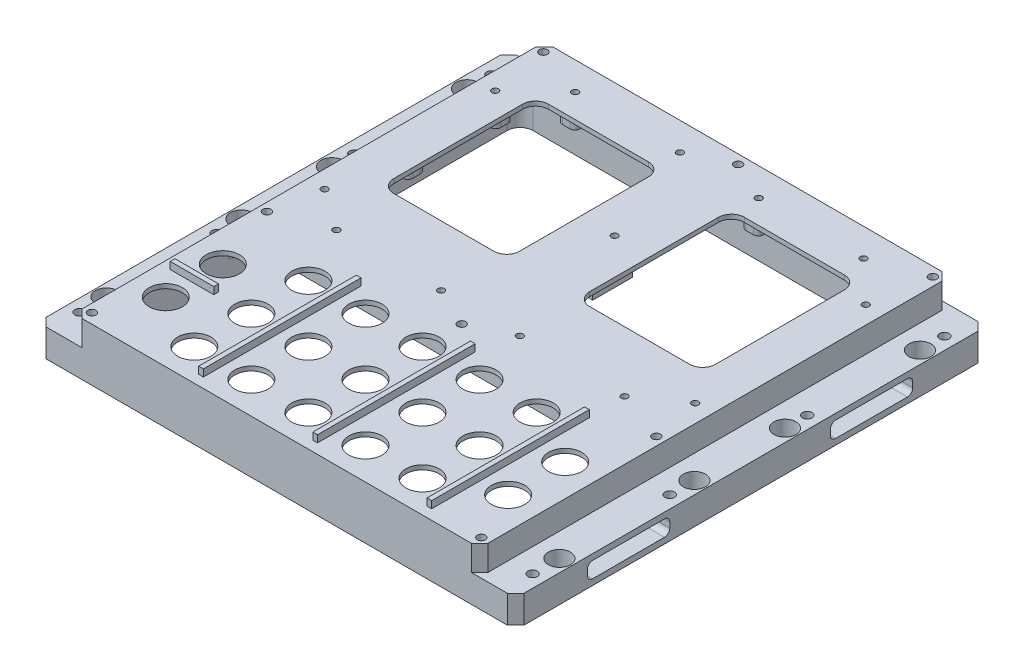
from build123d import *

# Parameters (mm, degrees)
BOSS_EXTRUDE1_DEPTH      = 22.8727
SKETCH3_W                = 15.5448
SKETCH3_H                = 10.922
CUT_EXTRUDE1_DEPTH       = 291.505693275
CHAMFER1_SIZE            = 3.556
SKETCH4_R                = 7.18185
CUT_EXTRUDE2_DEPTH       = 291.505693275
SKETCH5_W                = 18.796
SKETCH5_H                = 2.032
SKETCH5_W_2              = 2.032
SKETCH5_H_2              = 68.072
BOSS_EXTRUDE2_DEPTH      = 3.048
CUT_EXTRUDE3_DEPTH       = 7.874
FILLET1_R                = 2.286
CUT_EXTRUDE4_DEPTH       = 12.7
CUT_EXTRUDE5_DEPTH       = 20.9677
HOLE1_D                  = 4.0894
HOLE1_DEPTH              = 11.9507
HOLE1_CBORE_D            = 9.525
HOLE1_CBORE_DEPTH        = 9.652
HOLE1_TIP                = 1.228579708
HOLE2_D                  = 4.0894
HOLE3_D                  = 3.5052
HOLE3_DEPTH              = 7.62
SKETCH19_W               = 7.62
SKETCH19_H               = 17.272
SKETCH19_H_2             = 7.62
CUT_EXTRUDE6_DEPTH       = 20.9677
BOSS_EXTRUDE3_DEPTH      = 10.668
BOSS_EXTRUDE3_DEPTH_BACK = 2.54
SKETCH20_W               = 170.7896
SKETCH20_H               = 2.54
CUT_EXTRUDE7_DEPTH       = 11.938
BOSS_EXTRUDE4_START      = 4.572
SKETCH22_W               = 7.62
SKETCH22_H               = 17.272
SKETCH22_H_2             = 7.62
BOSS_EXTRUDE4_DEPTH      = 4.572
HOLE4_D                  = 2.8448
HOLE4_DEPTH              = 2.54


with BuildPart() as part:
    # Sketch1 → Boss-Extrude1 (new body)
    with BuildSketch(Plane(origin=(0, 0, 0), x_dir=(1, 0, 0), z_dir=(0, 1, 0))):
        Polygon((0, 199.644), (3.556, 203.2), (202.7936, 203.2), (206.3496, 199.644), (206.3496, 3.556), (202.7936, 0), (3.556, 0), (0, 3.556), align=None)
    extrude(amount=BOSS_EXTRUDE1_DEPTH)

    # Sketch3 → Cut-Extrude1 (cut, through all)
    with BuildSketch(Plane(origin=(0, 0, -203.2), x_dir=(-1, 0, 0), z_dir=(0, 0, -1))):
        with Locations((-198.5772, 17.4117)):
            Rectangle(SKETCH3_W, SKETCH3_H)
        with Locations((-7.7724, 17.4117)):
            Rectangle(SKETCH3_W, SKETCH3_H)
    extrude(amount=-CUT_EXTRUDE1_DEPTH, mode=Mode.SUBTRACT)

    # Chamfer1
    chamfer1_edges = [part.edges().sort_by_distance(p)[0] for p in [
        (190.8048, 17.4117, -203.2),
        (190.8048, 17.4117, 0),
        (15.5448, 17.4117, -203.2),
        (15.5448, 17.4117, 0),
    ]]
    chamfer(chamfer1_edges, length=CHAMFER1_SIZE)

    # Sketch4 → Cut-Extrude2 (cut, through all)
    with BuildSketch(Plane(origin=(0, 22.8727, 0), x_dir=(1, 0, 0), z_dir=(0, 1, 0))):
        with BuildLine():
            ThreePointArc((82.8548, 180.848), (86.806112693, 179.211312693), (88.4428, 175.26))
            Line((88.4428, 175.26), (88.4428, 119.634))
            ThreePointArc((88.4428, 119.634), (86.806112693, 115.682687307), (82.8548, 114.046))
            Line((82.8548, 114.046), (39.6748, 114.046))
            ThreePointArc((39.6748, 114.046), (35.723487307, 115.682687307), (34.0868, 119.634))
            Line((34.0868, 119.634), (34.0868, 175.26))
            ThreePointArc((34.0868, 175.26), (35.723487307, 179.211312693), (39.6748, 180.848))
            Line((39.6748, 180.848), (82.8548, 180.848))
        make_face()
        with BuildLine():
            Line((118.6688, 175.26), (118.6688, 119.634))
            ThreePointArc((118.6688, 119.634), (120.305487307, 115.682687307), (124.2568, 114.046))
            Line((124.2568, 114.046), (167.4368, 114.046))
            ThreePointArc((167.4368, 114.046), (171.388112693, 115.682687307), (173.0248, 119.634))
            Line((173.0248, 119.634), (173.0248, 175.26))
            ThreePointArc((173.0248, 175.26), (171.388112693, 179.211312693), (167.4368, 180.848))
            Line((167.4368, 180.848), (124.2568, 180.848))
            ThreePointArc((124.2568, 180.848), (120.305487307, 179.211312693), (118.6688, 175.26))
        make_face()
        with Locations(Location((127.7874, 62.992, 0), (0, 0, 270))):
            Circle(SKETCH4_R)
        with Locations(Location((103.1494, 62.992, 0), (0, 0, 270))):
            Circle(SKETCH4_R)
        with Locations(Location((53.8734, 38.354, 0), (0, 0, 270))):
            Circle(SKETCH4_R)
        with Locations(Location((53.8734, 13.716, 0), (0, 0, 270))):
            Circle(SKETCH4_R)
        with Locations(Location((78.5114, 62.992, 0), (0, 0, 270))):
            Circle(SKETCH4_R)
        with Locations(Location((53.8734, 62.992, 0), (0, 0, 270))):
            Circle(SKETCH4_R)
        with Locations(Location((29.2354, 50.673, 0), (0, 0, 270))):
            Circle(SKETCH4_R)
        with Locations(Location((29.2354, 26.035, 0), (0, 0, 270))):
            Circle(SKETCH4_R)
        with Locations(Location((78.5114, 38.354, 0), (0, 0, 270))):
            Circle(SKETCH4_R)
        with Locations(Location((103.1494, 38.354, 0), (0, 0, 270))):
            Circle(SKETCH4_R)
        with Locations(Location((127.7874, 38.354, 0), (0, 0, 270))):
            Circle(SKETCH4_R)
        with Locations(Location((152.4254, 62.992, 0), (0, 0, 270))):
            Circle(SKETCH4_R)
        with Locations(Location((177.0634, 50.673, 0), (0, 0, 270))):
            Circle(SKETCH4_R)
        with Locations(Location((177.0634, 26.035, 0), (0, 0, 270))):
            Circle(SKETCH4_R)
        with Locations(Location((152.4254, 38.354, 0), (0, 0, 270))):
            Circle(SKETCH4_R)
        with Locations(Location((152.4254, 13.716, 0), (0, 0, 270))):
            Circle(SKETCH4_R)
        with Locations(Location((127.7874, 13.716, 0), (0, 0, 270))):
            Circle(SKETCH4_R)
        with Locations(Location((103.1494, 13.716, 0), (0, 0, 270))):
            Circle(SKETCH4_R)
        with Locations(Location((78.5114, 13.716, 0), (0, 0, 270))):
            Circle(SKETCH4_R)
    extrude(amount=-CUT_EXTRUDE2_DEPTH, mode=Mode.SUBTRACT)

    # Sketch5 → Boss-Extrude2 (add)
    with BuildSketch(Plane(origin=(0, 22.8727, 0), x_dir=(1, 0, 0), z_dir=(0, 1, 0))):
        with Locations((29.2608, 38.354)):
            Rectangle(SKETCH5_W, SKETCH5_H)
        with Locations((66.1924, 38.354)):
            Rectangle(SKETCH5_W_2, SKETCH5_H_2)
        with Locations((115.4684, 38.354)):
            Rectangle(SKETCH5_W_2, SKETCH5_H_2)
        with Locations((164.7444, 38.354)):
            Rectangle(SKETCH5_W_2, SKETCH5_H_2)
    extrude(amount=BOSS_EXTRUDE2_DEPTH)

    # Sketch6 → Cut-Extrude3 (cut)
    with BuildSketch(Plane(origin=(0, 0, -203.2), x_dir=(-1, 0, 0), z_dir=(0, 0, -1))):
        with BuildLine():
            Line((-133.7056, 20.3327), (-109.5756, 20.3327))
            ThreePointArc((-109.5756, 20.3327), (-107.959153898, 19.663146102), (-107.2896, 18.0467))
            Line((-107.2896, 18.0467), (-107.2896, 4.826))
            ThreePointArc((-107.2896, 4.826), (-107.959153898, 3.209553898), (-109.5756, 2.54))
            Line((-109.5756, 2.54), (-133.7056, 2.54))
            ThreePointArc((-133.7056, 2.54), (-135.322046102, 3.209553898), (-135.9916, 4.826))
            Line((-135.9916, 4.826), (-135.9916, 18.0467))
            ThreePointArc((-135.9916, 18.0467), (-135.322046102, 19.663146102), (-133.7056, 20.3327))
        make_face()
        with BuildLine():
            Line((-174.5996, 20.3327), (-146.4056, 20.3327))
            ThreePointArc((-146.4056, 20.3327), (-144.789153898, 19.663146102), (-144.1196, 18.0467))
            Line((-144.1196, 18.0467), (-144.1196, 4.826))
            ThreePointArc((-144.1196, 4.826), (-144.789153898, 3.209553898), (-146.4056, 2.54))
            Line((-146.4056, 2.54), (-174.5996, 2.54))
            ThreePointArc((-174.5996, 2.54), (-176.216046102, 3.209553898), (-176.8856, 4.826))
            Line((-176.8856, 4.826), (-176.8856, 18.0467))
            ThreePointArc((-176.8856, 18.0467), (-176.216046102, 19.663146102), (-174.5996, 20.3327))
        make_face()
        with BuildLine():
            Line((-96.8756, 20.3327), (-72.7456, 20.3327))
            ThreePointArc((-72.7456, 20.3327), (-71.129153898, 19.663146102), (-70.4596, 18.0467))
            Line((-70.4596, 18.0467), (-70.4596, 4.826))
            ThreePointArc((-70.4596, 4.826), (-71.129153898, 3.209553898), (-72.7456, 2.54))
            Line((-72.7456, 2.54), (-96.8756, 2.54))
            ThreePointArc((-96.8756, 2.54), (-98.492046102, 3.209553898), (-99.1616, 4.826))
            Line((-99.1616, 4.826), (-99.1616, 18.0467))
            ThreePointArc((-99.1616, 18.0467), (-98.492046102, 19.663146102), (-96.8756, 20.3327))
        make_face()
        with BuildLine():
            Line((-59.7916, 20.3327), (-31.5976, 20.3327))
            ThreePointArc((-31.5976, 20.3327), (-29.981153898, 19.663146102), (-29.3116, 18.0467))
            Line((-29.3116, 18.0467), (-29.3116, 4.826))
            ThreePointArc((-29.3116, 4.826), (-29.981153898, 3.209553898), (-31.5976, 2.54))
            Line((-31.5976, 2.54), (-59.7916, 2.54))
            ThreePointArc((-59.7916, 2.54), (-61.408046102, 3.209553898), (-62.0776, 4.826))
            Line((-62.0776, 4.826), (-62.0776, 18.0467))
            ThreePointArc((-62.0776, 18.0467), (-61.408046102, 19.663146102), (-59.7916, 20.3327))
        make_face()
    extrude(amount=-CUT_EXTRUDE3_DEPTH, mode=Mode.SUBTRACT)

    # Fillet1
    fillet1_edges = [part.edges().sort_by_distance(p)[0] for p in [
        (29.981153898, 3.209553898, -195.326),
        (45.6946, 2.54, -195.326),
        (61.408046102, 3.209553898, -195.326),
        (62.0776, 11.43635, -195.326),
        (61.408046102, 19.663146102, -195.326),
        (45.6946, 20.3327, -195.326),
        (29.981153898, 19.663146102, -195.326),
        (29.3116, 11.43635, -195.326),
        (107.959153898, 3.209553898, -195.326),
        (121.6406, 2.54, -195.326),
        (135.322046102, 3.209553898, -195.326),
        (135.9916, 11.43635, -195.326),
        (135.322046102, 19.663146102, -195.326),
        (121.6406, 20.3327, -195.326),
        (107.959153898, 19.663146102, -195.326),
        (107.2896, 11.43635, -195.326),
        (144.789153898, 19.663146102, -195.326),
        (144.1196, 11.43635, -195.326),
        (144.789153898, 3.209553898, -195.326),
        (160.5026, 2.54, -195.326),
        (176.216046102, 3.209553898, -195.326),
        (176.8856, 11.43635, -195.326),
        (176.216046102, 19.663146102, -195.326),
        (160.5026, 20.3327, -195.326),
        (71.129153898, 3.209553898, -195.326),
        (84.8106, 2.54, -195.326),
        (98.492046102, 3.209553898, -195.326),
        (99.1616, 11.43635, -195.326),
        (98.492046102, 19.663146102, -195.326),
        (84.8106, 20.3327, -195.326),
        (71.129153898, 19.663146102, -195.326),
        (70.4596, 11.43635, -195.326),
    ]]
    fillet(fillet1_edges, radius=FILLET1_R)

    # Sketch7 → Cut-Extrude4 (cut)
    with BuildSketch(Plane(origin=(206.3496, 0, 0), x_dir=(0, 0, -1), z_dir=(1, 0, 0))):
        with BuildLine():
            Line((33.274, 2.54), (64.262, 2.54))
            ThreePointArc((64.262, 2.54), (65.878446102, 3.209553898), (66.548, 4.826))
            Line((66.548, 4.826), (66.548, 7.1247))
            ThreePointArc((66.548, 7.1247), (65.878446102, 8.741146102), (64.262, 9.4107))
            Line((64.262, 9.4107), (33.274, 9.4107))
            ThreePointArc((33.274, 9.4107), (31.657553898, 8.741146102), (30.988, 7.1247))
            Line((30.988, 7.1247), (30.988, 4.826))
            ThreePointArc((30.988, 4.826), (31.657553898, 3.209553898), (33.274, 2.54))
        make_face()
        with BuildLine():
            Line((138.176, 2.54), (169.164, 2.54))
            ThreePointArc((169.164, 2.54), (170.780446102, 3.209553898), (171.45, 4.826))
            Line((171.45, 4.826), (171.45, 7.1247))
            ThreePointArc((171.45, 7.1247), (170.780446102, 8.741146102), (169.164, 9.4107))
            Line((169.164, 9.4107), (138.176, 9.4107))
            ThreePointArc((138.176, 9.4107), (136.559553898, 8.741146102), (135.89, 7.1247))
            Line((135.89, 7.1247), (135.89, 4.826))
            ThreePointArc((135.89, 4.826), (136.559553898, 3.209553898), (138.176, 2.54))
        make_face()
    cut_extrude4 = extrude(amount=-CUT_EXTRUDE4_DEPTH, mode=Mode.SUBTRACT)

    # Mirror1: Cut-Extrude4 across plane
    add(cut_extrude4.mirror(Plane(origin=(103.1748, 0, 0), x_dir=(0, 0, 1), z_dir=(1, 0, 0))), mode=Mode.SUBTRACT)

    # Sketch8 → Cut-Extrude5 (cut)
    with BuildSketch(Plane.XZ):
        with BuildLine():
            Line((39.37, -2.54), (50.465632402, -2.54))
            ThreePointArc((50.465632402, -2.54), (58.685846042, -3.069112235), (64.514150913, -8.89))
            Line((64.514150913, -8.89), (67.870649087, -8.89))
            ThreePointArc((67.870649087, -8.89), (73.698953958, -3.069112235), (81.919167598, -2.54))
            Line((81.919167598, -2.54), (99.741632402, -2.54))
            ThreePointArc((99.741632402, -2.54), (103.1494, -2.032), (106.557167598, -2.54))
            Line((106.557167598, -2.54), (124.379632402, -2.54))
            ThreePointArc((124.379632402, -2.54), (132.599846042, -3.069112235), (138.428150913, -8.89))
            Line((138.428150913, -8.89), (141.784649087, -8.89))
            ThreePointArc((141.784649087, -8.89), (147.612953958, -3.069112235), (155.833167598, -2.54))
            Line((155.833167598, -2.54), (166.9796, -2.54))
            ThreePointArc((166.9796, -2.54), (177.059912495, -5.425538982), (184.086457572, -13.208))
            ThreePointArc((184.086457572, -13.208), (187.305931631, -15.146490256), (188.5696, -18.685685072))
            Line((188.5696, -18.685685072), (188.5696, -64.626314928))
            ThreePointArc((188.5696, -64.626314928), (187.305931631, -68.165509744), (184.086457572, -70.104))
            ThreePointArc((184.086457572, -70.104), (182.165694238, -73.383529769), (178.591597429, -74.676))
            Line((178.591597429, -74.676), (27.758002571, -74.676))
            ThreePointArc((27.758002571, -74.676), (24.183905762, -73.383529769), (22.263142428, -70.104))
            ThreePointArc((22.263142428, -70.104), (19.043668369, -68.165509744), (17.78, -64.626314928))
            Line((17.78, -64.626314928), (17.78, -18.685685072))
            ThreePointArc((17.78, -18.685685072), (19.043668369, -15.146490256), (22.263142428, -13.208))
            ThreePointArc((22.263142428, -13.208), (29.289687505, -5.425538982), (39.37, -2.54))
        make_face()
    extrude(amount=-CUT_EXTRUDE5_DEPTH, mode=Mode.SUBTRACT)

    # Hole1
    with Locations(Plane(origin=(0, 11.9507, 0), x_dir=(1, 0, 0), z_dir=(0, 1, 0))):
        with Locations((5.3848, 82.55), (5.3848, 121.666), (5.3848, 179.959), (5.3848, 24.257), (200.9648, 24.257), (200.9648, 82.55), (200.9648, 121.666), (200.9648, 179.959)):
            CounterBoreHole(HOLE1_D / 2, HOLE1_CBORE_D / 2, HOLE1_CBORE_DEPTH, depth=HOLE1_DEPTH)
            with Locations((0, 0, -(HOLE1_DEPTH + HOLE1_TIP / 2))):  # 118° drill point
                Cone(0, HOLE1_D / 2, HOLE1_TIP, mode=Mode.SUBTRACT)

    # Hole2 (through all)
    with Locations(Plane(origin=(0, 11.9507, 0), x_dir=(1, 0, 0), z_dir=(0, 1, 0))):
        with Locations((5.3848, 190.5), (5.3848, 131.318), (5.3848, 71.882), (5.3848, 12.7), (200.9648, 12.7), (200.9648, 71.882), (200.9648, 131.318), (200.9648, 190.5)):
            Hole(HOLE2_D / 2)

    # Hole3
    with Locations(Plane(origin=(0, 22.8727, 0), x_dir=(1, 0, 0), z_dir=(0, 1, 0))):
        with Locations((19.0754, 199.263), (19.0754, 79.883), (19.0754, 4.318), (103.1494, 79.883), (187.2234, 79.883), (187.2234, 4.318), (187.2234, 199.263), (103.1494, 199.263)):
            Hole(HOLE3_D / 2, depth=HOLE3_DEPTH)

    # Sketch19 → Cut-Extrude6 (cut)
    with BuildSketch(Plane.XZ):
        with BuildLine():
            Line((31.539567742, -190.5), (37.1856, -190.5))
            Line((37.1856, -190.5), (37.1856, -189.484))
            ThreePointArc((37.1856, -189.484), (37.855153898, -187.867553898), (39.4716, -187.198))
            Line((39.4716, -187.198), (42.5196, -187.198))
            ThreePointArc((42.5196, -187.198), (44.136046102, -187.867553898), (44.8056, -189.484))
            Line((44.8056, -189.484), (44.8056, -190.5))
            Line((44.8056, -190.5), (82.3976, -190.5))
            Line((82.3976, -190.5), (82.3976, -189.484))
            ThreePointArc((82.3976, -189.484), (83.067153898, -187.867553898), (84.6836, -187.198))
            Line((84.6836, -187.198), (87.7316, -187.198))
            ThreePointArc((87.7316, -187.198), (89.348046102, -187.867553898), (90.0176, -189.484))
            Line((90.0176, -189.484), (90.0176, -190.5))
            Line((90.0176, -190.5), (116.4336, -190.5))
            Line((116.4336, -190.5), (116.4336, -189.484))
            ThreePointArc((116.4336, -189.484), (117.103153898, -187.867553898), (118.7196, -187.198))
            Line((118.7196, -187.198), (121.7676, -187.198))
            ThreePointArc((121.7676, -187.198), (123.384046102, -187.867553898), (124.0536, -189.484))
            Line((124.0536, -189.484), (124.0536, -190.5))
            Line((124.0536, -190.5), (161.6456, -190.5))
            Line((161.6456, -190.5), (161.6456, -189.484))
            ThreePointArc((161.6456, -189.484), (162.315153898, -187.867553898), (163.9316, -187.198))
            Line((163.9316, -187.198), (166.9796, -187.198))
            ThreePointArc((166.9796, -187.198), (168.596046102, -187.867553898), (169.2656, -189.484))
            Line((169.2656, -189.484), (169.2656, -190.5))
            Line((169.2656, -190.5), (182.9816, -190.5))
            ThreePointArc((182.9816, -190.5), (186.932912693, -188.863312693), (188.5696, -184.912))
            Line((188.5696, -184.912), (188.5696, -180.467))
            ThreePointArc((188.5696, -180.467), (187.900046102, -178.850553898), (186.2836, -178.181))
            Line((186.2836, -178.181), (181.4576, -178.181))
            ThreePointArc((181.4576, -178.181), (179.841153898, -177.511446102), (179.1716, -175.895))
            Line((179.1716, -175.895), (179.1716, -172.847))
            ThreePointArc((179.1716, -172.847), (179.841153898, -171.230553898), (181.4576, -170.561))
            Line((181.4576, -170.561), (186.2836, -170.561))
            ThreePointArc((186.2836, -170.561), (187.900046102, -169.891446102), (188.5696, -168.275))
            Line((188.5696, -168.275), (188.5696, -120.65))
            ThreePointArc((188.5696, -120.65), (187.900046102, -119.033553898), (186.2836, -118.364))
            Line((186.2836, -118.364), (181.4576, -118.364))
            ThreePointArc((181.4576, -118.364), (179.841153898, -117.694446102), (179.1716, -116.078))
            Line((179.1716, -116.078), (179.1716, -99.06))
            ThreePointArc((179.1716, -99.06), (179.841153898, -97.443553898), (181.4576, -96.774))
            Line((181.4576, -96.774), (186.2836, -96.774))
            ThreePointArc((186.2836, -96.774), (187.900046102, -96.104446102), (188.5696, -94.488))
            Line((188.5696, -94.488), (188.5696, -86.614))
            ThreePointArc((188.5696, -86.614), (187.900046102, -84.997553898), (186.2836, -84.328))
            Line((186.2836, -84.328), (181.4576, -84.328))
            ThreePointArc((181.4576, -84.328), (179.841153898, -83.658446102), (179.1716, -82.042))
            Line((179.1716, -82.042), (179.1716, -80.264))
            ThreePointArc((179.1716, -80.264), (178.502046102, -78.647553898), (176.8856, -77.978))
            Line((176.8856, -77.978), (171.5516, -77.978))
            ThreePointArc((171.5516, -77.978), (169.935153898, -78.647553898), (169.2656, -80.264))
            Line((169.2656, -80.264), (169.2656, -89.408))
            ThreePointArc((169.2656, -89.408), (168.596046102, -91.024446102), (166.9796, -91.694))
            Line((166.9796, -91.694), (163.9316, -91.694))
            ThreePointArc((163.9316, -91.694), (162.315153898, -91.024446102), (161.6456, -89.408))
            Line((161.6456, -89.408), (161.6456, -80.264))
            ThreePointArc((161.6456, -80.264), (160.976046102, -78.647553898), (159.3596, -77.978))
            Line((159.3596, -77.978), (126.3396, -77.978))
            ThreePointArc((126.3396, -77.978), (124.723153898, -78.647553898), (124.0536, -80.264))
            Line((124.0536, -80.264), (124.0536, -89.408))
            ThreePointArc((124.0536, -89.408), (123.384046102, -91.024446102), (121.7676, -91.694))
            Line((121.7676, -91.694), (118.7196, -91.694))
            ThreePointArc((118.7196, -91.694), (117.103153898, -91.024446102), (116.4336, -89.408))
            Line((116.4336, -89.408), (116.4336, -80.264))
            ThreePointArc((116.4336, -80.264), (115.764046102, -78.647553898), (114.1476, -77.978))
            Line((114.1476, -77.978), (109.3216, -77.978))
            ThreePointArc((109.3216, -77.978), (107.705153898, -78.647553898), (107.0356, -80.264))
            Line((107.0356, -80.264), (107.0356, -82.042))
            ThreePointArc((107.0356, -82.042), (106.366046102, -83.658446102), (104.7496, -84.328))
            Line((104.7496, -84.328), (101.7016, -84.328))
            ThreePointArc((101.7016, -84.328), (100.085153898, -83.658446102), (99.4156, -82.042))
            Line((99.4156, -82.042), (99.4156, -80.264))
            ThreePointArc((99.4156, -80.264), (98.746046102, -78.647553898), (97.1296, -77.978))
            Line((97.1296, -77.978), (92.3036, -77.978))
            ThreePointArc((92.3036, -77.978), (90.687153898, -78.647553898), (90.0176, -80.264))
            Line((90.0176, -80.264), (90.0176, -89.408))
            ThreePointArc((90.0176, -89.408), (89.348046102, -91.024446102), (87.7316, -91.694))
            Line((87.7316, -91.694), (84.6836, -91.694))
            ThreePointArc((84.6836, -91.694), (83.067153898, -91.024446102), (82.3976, -89.408))
            Line((82.3976, -89.408), (82.3976, -80.264))
            ThreePointArc((82.3976, -80.264), (81.728046102, -78.647553898), (80.1116, -77.978))
            Line((80.1116, -77.978), (47.0916, -77.978))
            ThreePointArc((47.0916, -77.978), (45.475153898, -78.647553898), (44.8056, -80.264))
            Line((44.8056, -80.264), (44.8056, -89.408))
            ThreePointArc((44.8056, -89.408), (44.136046102, -91.024446102), (42.5196, -91.694))
            Line((42.5196, -91.694), (39.4716, -91.694))
            ThreePointArc((39.4716, -91.694), (37.855153898, -91.024446102), (37.1856, -89.408))
            Line((37.1856, -89.408), (37.1856, -80.264))
            ThreePointArc((37.1856, -80.264), (36.516046102, -78.647553898), (34.8996, -77.978))
            Line((34.8996, -77.978), (29.464, -77.978))
            ThreePointArc((29.464, -77.978), (27.847553898, -78.647553898), (27.178, -80.264))
            Line((27.178, -80.264), (27.178, -82.042))
            ThreePointArc((27.178, -82.042), (26.508446102, -83.658446102), (24.892, -84.328))
            Line((24.892, -84.328), (20.066, -84.328))
            ThreePointArc((20.066, -84.328), (18.449553898, -84.997553898), (17.78, -86.614))
            Line((17.78, -86.614), (17.78, -94.488))
            ThreePointArc((17.78, -94.488), (18.449553898, -96.104446102), (20.066, -96.774))
            Line((20.066, -96.774), (24.892, -96.774))
            ThreePointArc((24.892, -96.774), (26.508446102, -97.443553898), (27.178, -99.06))
            Line((27.178, -99.06), (27.178, -116.078))
            ThreePointArc((27.178, -116.078), (26.508446102, -117.694446102), (24.892, -118.364))
            Line((24.892, -118.364), (20.066, -118.364))
            ThreePointArc((20.066, -118.364), (18.449553898, -119.033553898), (17.78, -120.65))
            Line((17.78, -120.65), (17.78, -130.302))
            ThreePointArc((17.78, -130.302), (18.449553898, -131.918446102), (20.066, -132.588))
            Line((20.066, -132.588), (24.892, -132.588))
            ThreePointArc((24.892, -132.588), (26.508446102, -133.257553898), (27.178, -134.874))
            Line((27.178, -134.874), (27.178, -137.922))
            ThreePointArc((27.178, -137.922), (26.508446102, -139.538446102), (24.892, -140.208))
            Line((24.892, -140.208), (20.066, -140.208))
            ThreePointArc((20.066, -140.208), (18.449553898, -140.877553898), (17.78, -142.494))
            Line((17.78, -142.494), (17.78, -168.275))
            ThreePointArc((17.78, -168.275), (18.449553898, -169.891446102), (20.066, -170.561))
            Line((20.066, -170.561), (24.892, -170.561))
            ThreePointArc((24.892, -170.561), (26.508446102, -171.230553898), (27.178, -172.847))
            Line((27.178, -172.847), (27.178, -175.895))
            ThreePointArc((27.178, -175.895), (26.508446102, -177.511446102), (24.892, -178.181))
            Line((24.892, -178.181), (20.066, -178.181))
            ThreePointArc((20.066, -178.181), (18.449553898, -178.850553898), (17.78, -180.467))
            Line((17.78, -180.467), (17.78, -184.912))
            ThreePointArc((17.78, -184.912), (19.416687307, -188.863312693), (23.368, -190.5))
            Line((23.368, -190.5), (31.539567742, -190.5))
        make_face()
        with Locations((103.2256, -141.224)):
            Rectangle(SKETCH19_W, SKETCH19_H, mode=Mode.SUBTRACT)
        with Locations((76.3016, -104.648)):
            Rectangle(SKETCH19_W, SKETCH19_H_2, mode=Mode.SUBTRACT)
        with Locations((130.4036, -104.648)):
            Rectangle(SKETCH19_W, SKETCH19_H_2, mode=Mode.SUBTRACT)
    extrude(amount=-CUT_EXTRUDE6_DEPTH, mode=Mode.SUBTRACT)

    # Sketch20 → Boss-Extrude3 (add, two sides: drawn at the far end of the back side and taken through both)
    with BuildSketch(Plane(origin=(0, 0, -2.54), x_dir=(-1, 0, 0), z_dir=(0, 0, -1)).offset(-BOSS_EXTRUDE3_DEPTH_BACK)):
        with Locations((-103.1748, 1.27)):
            Rectangle(SKETCH20_W, SKETCH20_H)
    extrude(amount=BOSS_EXTRUDE3_DEPTH + BOSS_EXTRUDE3_DEPTH_BACK)

    # Sketch21 → Cut-Extrude7 (cut)
    with BuildSketch(Plane.XZ):
        with BuildLine():
            Line((184.086457572, -13.208), (22.263142428, -13.208))
            ThreePointArc((22.263142428, -13.208), (19.043668369, -15.146490256), (17.78, -18.685685072))
            Line((17.78, -18.685685072), (17.78, -184.912))
            ThreePointArc((17.78, -184.912), (19.416687307, -188.863312693), (23.368, -190.5))
            Line((23.368, -190.5), (182.9816, -190.5))
            ThreePointArc((182.9816, -190.5), (186.932912693, -188.863312693), (188.5696, -184.912))
            Line((188.5696, -184.912), (188.5696, -18.685685072))
            ThreePointArc((188.5696, -18.685685072), (187.305931631, -15.146490256), (184.086457572, -13.208))
        make_face()
    extrude(amount=-CUT_EXTRUDE7_DEPTH, mode=Mode.SUBTRACT)

    # Sketch22 → Boss-Extrude4 (add)
    with BuildSketch(Plane.XZ.offset(-11.938).offset(BOSS_EXTRUDE4_START)):
        with BuildLine():
            Line((20.066, -96.774), (24.892, -96.774))
            ThreePointArc((24.892, -96.774), (26.508446102, -97.443553898), (27.178, -99.06))
            Line((27.178, -99.06), (27.178, -108.458))
            Line((27.178, -108.458), (20.066, -108.458))
            ThreePointArc((20.066, -108.458), (18.449553898, -109.127553898), (17.78, -110.744))
            Line((17.78, -110.744), (17.78, -94.488))
            ThreePointArc((17.78, -94.488), (18.449553898, -96.104446102), (20.066, -96.774))
        make_face()
        with Locations((103.2256, -141.224)):
            Rectangle(SKETCH22_W, SKETCH22_H)
        with Locations((76.3016, -104.648)):
            Rectangle(SKETCH22_W, SKETCH22_H_2)
        with Locations((130.4036, -104.648)):
            Rectangle(SKETCH22_W, SKETCH22_H_2)
        with BuildLine():
            Line((188.5696, -110.744), (188.5696, -94.488))
            ThreePointArc((188.5696, -94.488), (187.900046102, -96.104446102), (186.2836, -96.774))
            Line((186.2836, -96.774), (181.4576, -96.774))
            ThreePointArc((181.4576, -96.774), (179.841153898, -97.443553898), (179.1716, -99.06))
            Line((179.1716, -99.06), (179.1716, -108.458))
            Line((179.1716, -108.458), (186.2836, -108.458))
            ThreePointArc((186.2836, -108.458), (187.900046102, -109.127553898), (188.5696, -110.744))
        make_face()
    extrude(amount=-BOSS_EXTRUDE4_DEPTH)

    # Hole4
    with Locations(Plane(origin=(0, 22.8727, 0), x_dir=(1, 0, 0), z_dir=(0, 1, 0))):
        with Locations((23.1394, 174.371), (40.9194, 191.135), (86.1314, 191.135), (120.1674, 191.135), (165.3794, 191.135), (183.1594, 174.371), (183.1594, 100.711), (165.3794, 88.011), (120.1674, 88.011), (86.1314, 88.011), (40.9194, 88.011), (23.1394, 100.711), (103.1494, 145.923)):
            Hole(HOLE4_D / 2, depth=HOLE4_DEPTH)


solid = part.part
